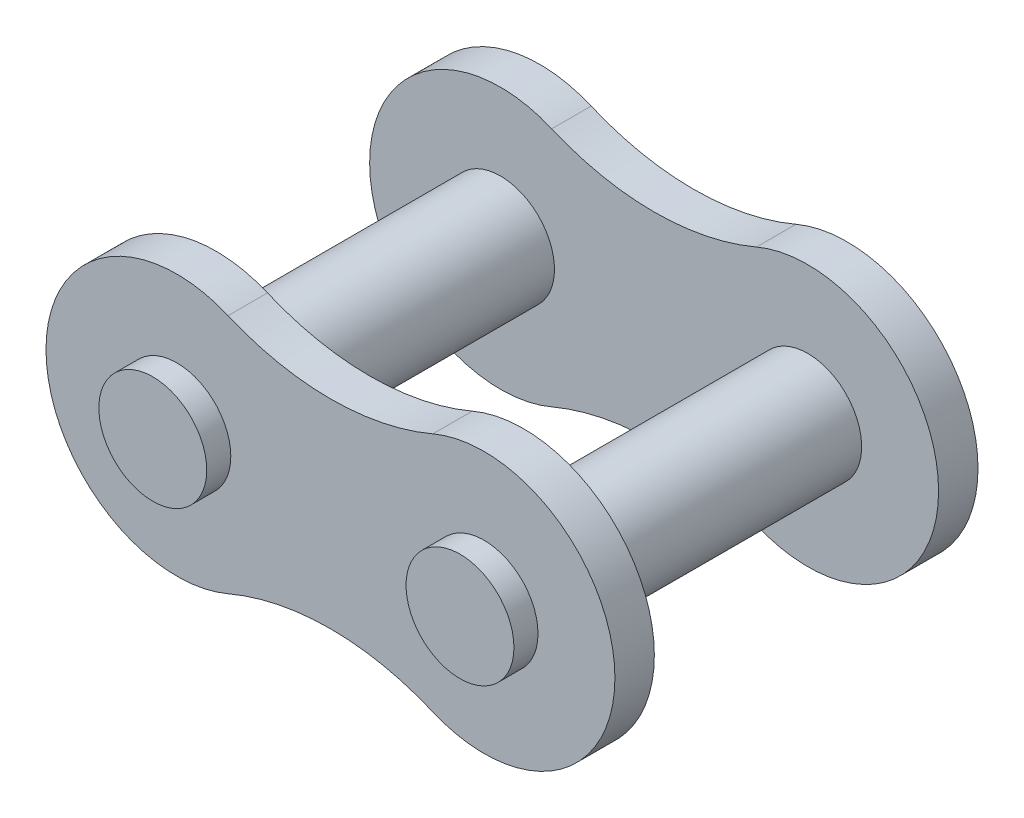
from build123d import *

# Parameters (mm, degrees)
SKETCH_1_R        = 2.23
EXTRUDE_1_DEPTH   = 8.5
EXTRUDE_1_2_DEPTH = 8.5
EXTRUDE_START     = 5.875
EXTRUDE_2_DEPTH   = 1.63


with BuildPart() as part:
    # Эскиз1 → Бобышка-Вытянуть1 (new, symmetric)
    with BuildSketch(Plane.XY):
        with Locations((-6.35, 0)):
            Circle(SKETCH_1_R)
    extrude(amount=EXTRUDE_1_DEPTH, both=True)



with BuildPart() as body_2:
    # Эскиз1 → Extrude 1 2 (new, symmetric)
    with BuildSketch(Plane.XY):
        with Locations((6.35, 0)):
            Circle(SKETCH_1_R)
    extrude(amount=EXTRUDE_1_2_DEPTH, both=True)


with BuildPart() as part_1:
    add(part.part)

    add(body_2.part)  # Бобышка-Вытянуть2 merges body 2
    # Эскиз2 → Бобышка-Вытянуть2 (add)
    with BuildSketch(Plane.XY.offset(EXTRUDE_START)):
        with BuildLine():
            ThreePointArc((-4.23202836, 4.978182011), (-11.76, 0), (-4.23202836, -4.978182011))
            ThreePointArc((-4.23202836, -4.978182011), (0, -4.115344217), (4.23202836, -4.978182011))
            ThreePointArc((4.23202836, -4.978182011), (11.76, 0), (4.23202836, 4.978182011))
            ThreePointArc((4.23202836, 4.978182011), (0, 4.115344217), (-4.23202836, 4.978182011))
        make_face()
    extrude_2 = extrude(amount=EXTRUDE_2_DEPTH)

    # Зеркальное отражение1: Бобышка-Вытянуть2 across plane
    add(extrude_2.mirror(Plane.XY))


solid = part_1.part
